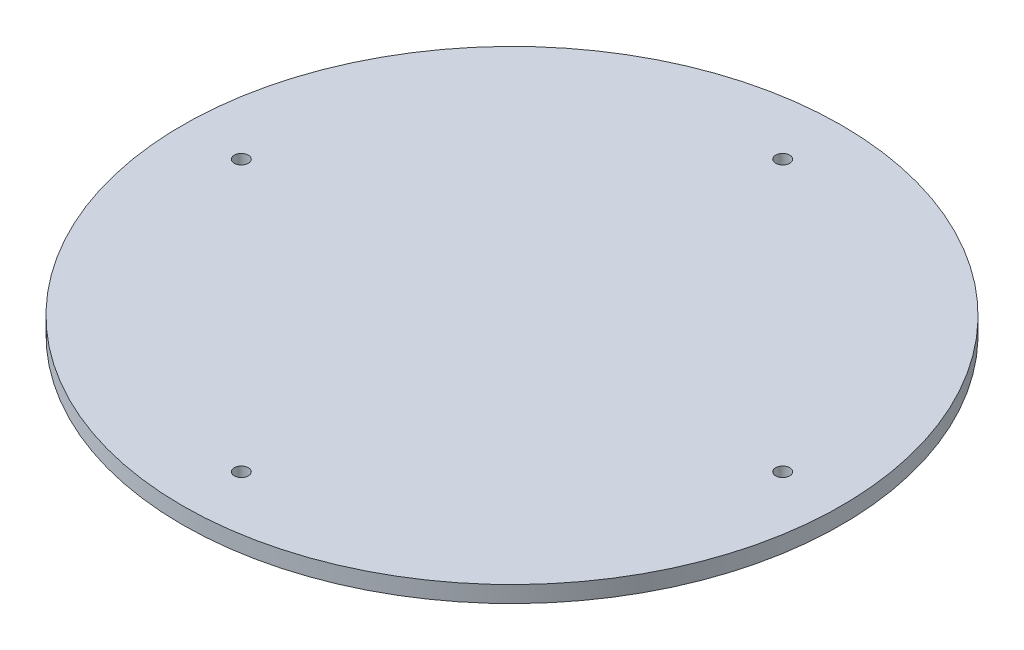
from build123d import *

# Parameters (mm, degrees)
SKETCH1_R           = 70
BOSS_EXTRUDE1_DEPTH = 3.5
SKETCH2_R           = 1.5
CUT_EXTRUDE1_DEPTH  = 3.5
CIRPATTERN1_COUNT   = 4


with BuildPart() as part:
    # Sketch1 → Boss-Extrude1 (new body)
    with BuildSketch(Plane(origin=(0, 0, 0), x_dir=(1, 0, 0), z_dir=(0, 1, 0))):
        with Locations(Location((0, 0, 0), (0, 0, 270))):
            Circle(SKETCH1_R)
    extrude(amount=BOSS_EXTRUDE1_DEPTH)

    # Sketch2 → Cut-Extrude1 (cut)
    with BuildSketch(Plane(origin=(0, 3.5, 0), x_dir=(1, 0, 0), z_dir=(0, 1, 0))):
        with Locations(Location((57.5, 0, 0), (0, 0, 270))):
            Circle(SKETCH2_R)
    cut_extrude1 = extrude(amount=-CUT_EXTRUDE1_DEPTH, mode=Mode.SUBTRACT)

    # CirPattern1: Cut-Extrude1 ×4 about axis
    cirpattern1_axis = Axis((0, 0, 0), (0, 1, 0))
    for i in range(1, CIRPATTERN1_COUNT):
        add(cut_extrude1.rotate(cirpattern1_axis, i * 360 / CIRPATTERN1_COUNT), mode=Mode.SUBTRACT)


solid = part.part
